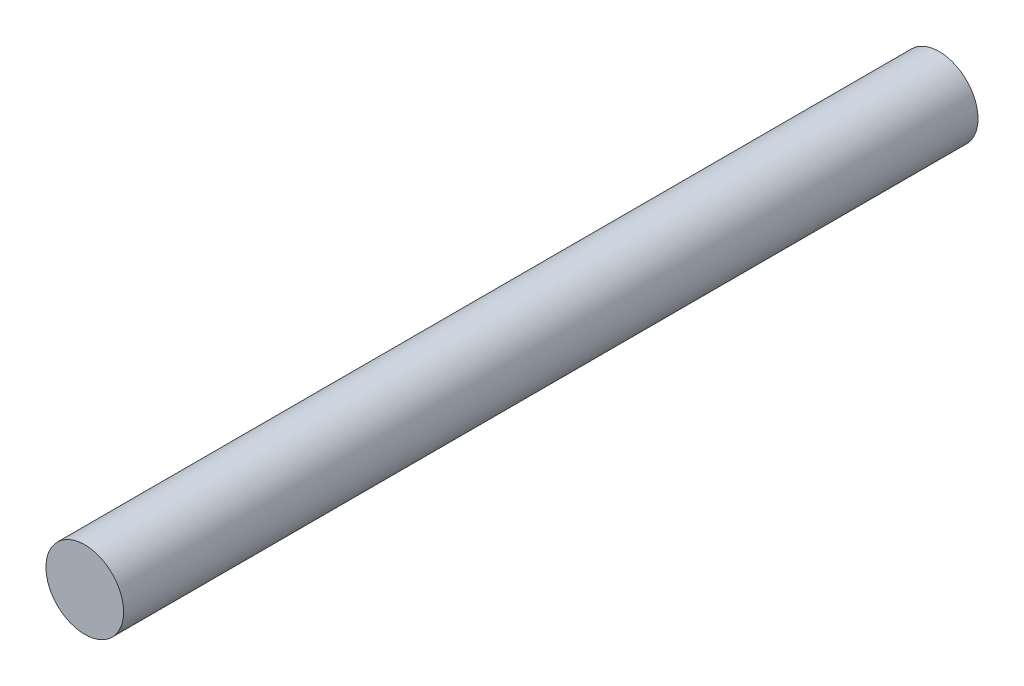
from build123d import *

# Parameters (mm, degrees)
SKETCH_1_R      = 1
EXTRUDE_1_DEPTH = 22


with BuildPart() as part:
    # 草图1 → 凸台-拉伸1 (new body)
    with BuildSketch(Plane.XY):
        Circle(SKETCH_1_R)
    extrude(amount=EXTRUDE_1_DEPTH)


solid = part.part
